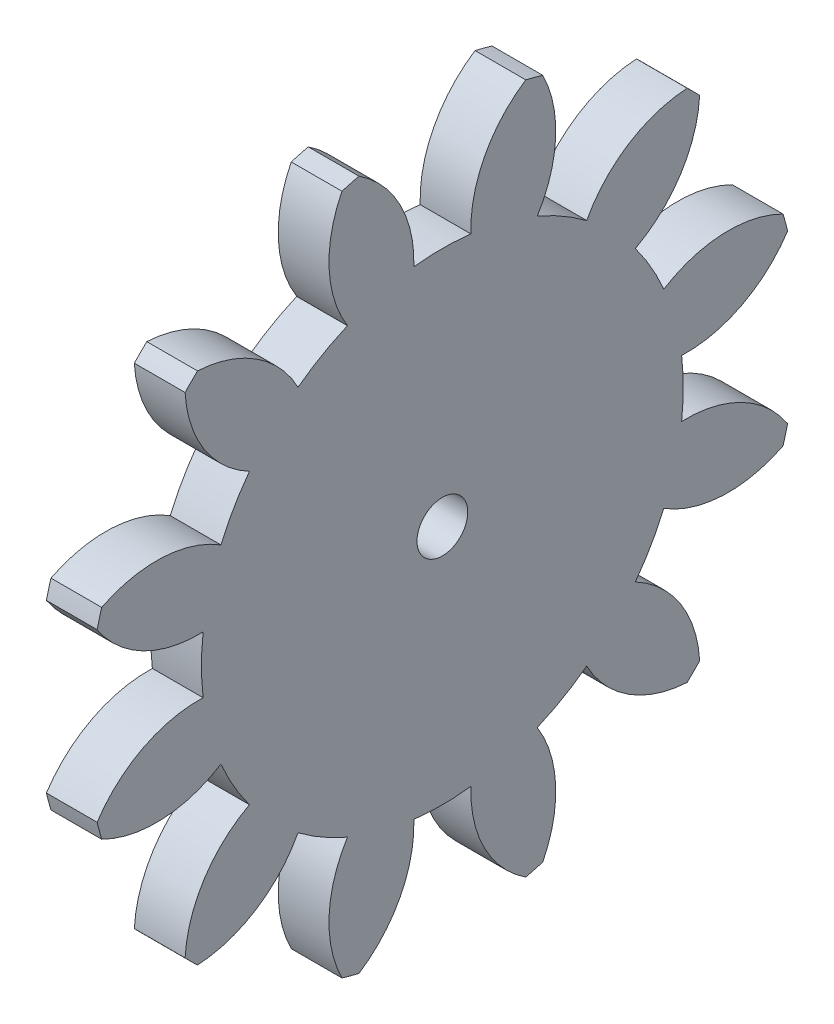
from build123d import *

# Parameters (mm, degrees)
BASPROSKE_W     = 1
BASPROSKE_H     = 7
TOOTHCUT_DEPTH  = 10.949874371
TEETHCUTS_COUNT = 12
TEETHCUTS_ANGLE = 330
BORSKE_R        = 0.5
BORE_DEPTH      = 50.0000508


with BuildPart() as part:
    # BasProSke → Base-Revolve (revolve)
    with BuildSketch(Plane(origin=(0, 0, 0), x_dir=(1, 0, 0), z_dir=(0, 1, 0)), mode=Mode.PRIVATE) as base_revolve_sk:
        with Locations((0.5, 3.5)):
            Rectangle(BASPROSKE_W, BASPROSKE_H)
    revolve(base_revolve_sk.sketch.rotate(Axis((-10, 0, 0), (1, 0, 0)), 180), axis=Axis((-10, 0, 0), (1, 0, 0)))

    # TooCutSke → ToothCut (cut, through all)
    with BuildSketch(Plane(origin=(0, 0, 0), x_dir=(0, 0, -1), z_dir=(1, 0, 0))):
        with BuildLine():
            ThreePointArc((0.562207301, 4.715604304), (0, 4.749), (-0.562207301, 4.715604304))
            ThreePointArc((-0.562207301, 4.715604304), (-0.837528627, 5.917009812), (-1.672850686, 6.823328788))
            ThreePointArc((-1.672850686, 6.823328788), (0, 7.0254), (1.672850686, 6.823328788))
            ThreePointArc((1.672850686, 6.823328788), (0.837528627, 5.917009812), (0.562207301, 4.715604304))
        make_face()
    toothcut = extrude(amount=TOOTHCUT_DEPTH, mode=Mode.SUBTRACT)

    # TeethCuts: ToothCut ×12 about axis
    teethcuts_axis = Axis((-10, 0, 0), (1, 0, 0))
    for i in range(1, TEETHCUTS_COUNT):
        add(toothcut.rotate(teethcuts_axis, i * TEETHCUTS_ANGLE / (TEETHCUTS_COUNT - 1)), mode=Mode.SUBTRACT)

    # BorSke → Bore (cut, symmetric)
    with BuildSketch(Plane(origin=(0, 0, 0), x_dir=(0, 0, -1), z_dir=(1, 0, 0))):
        with Locations(Location((0, 0, 0), (0, 0, 180))):
            Circle(BORSKE_R)
    extrude(amount=BORE_DEPTH, both=True, mode=Mode.SUBTRACT)


solid = part.part
